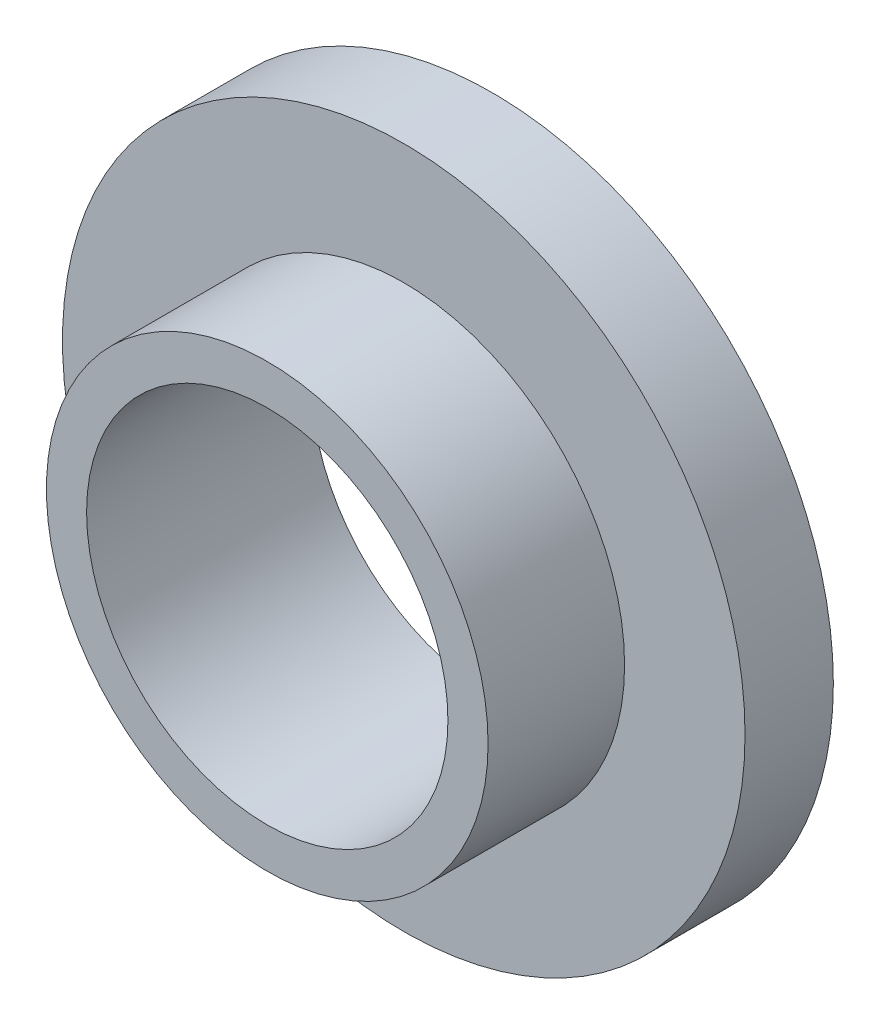
from build123d import *

# Parameters (mm, degrees)
SKETCH1_R           = 4.25
SKETCH1_R_2         = 2.25
BOSS_EXTRUDE1_DEPTH = 1.1
SKETCH2_R           = 2.75
SKETCH2_R_2         = 2.25
BOSS_EXTRUDE2_DEPTH = 1.7


with BuildPart() as part:
    # Sketch1 → Boss-Extrude1 (new body)
    with BuildSketch(Plane.XY):
        Circle(SKETCH1_R)
        Circle(SKETCH1_R_2, mode=Mode.SUBTRACT)
    extrude(amount=BOSS_EXTRUDE1_DEPTH)

    # Sketch2 → Boss-Extrude2 (add)
    with BuildSketch(Plane.XY.offset(1.1)):
        Circle(SKETCH2_R)
        Circle(SKETCH2_R_2, mode=Mode.SUBTRACT)
    extrude(amount=BOSS_EXTRUDE2_DEPTH)


solid = part.part
